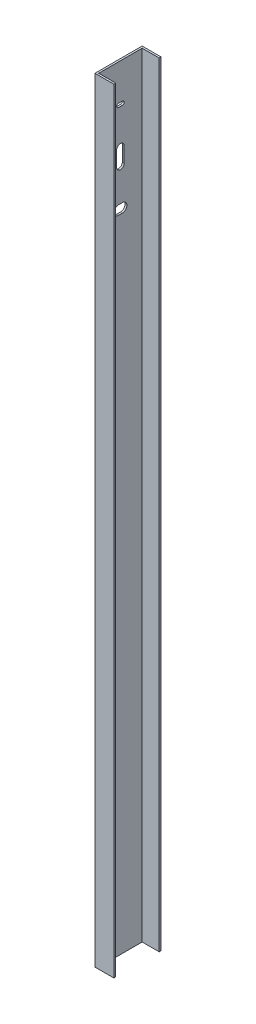
from build123d import *

# Parameters (mm, degrees)
SKETCH1_W           = 10
SKETCH1_H           = 25
BOSS_EXTRUDE1_DEPTH = 410
SKETCH2_W           = 9
SKETCH2_H           = 23
CUT_EXTRUDE1_DEPTH  = 410
CUT_EXTRUDE2_DEPTH  = 410
CUT_EXTRUDE3_DEPTH  = 410
CUT_EXTRUDE4_DEPTH  = 410


with BuildPart() as part:
    # Sketch1 → Boss-Extrude1 (new body)
    with BuildSketch(Plane(origin=(0, 0, 0), x_dir=(1, 0, 0), z_dir=(0, 1, 0))):
        with Locations((5, -12.5)):
            Rectangle(SKETCH1_W, SKETCH1_H)
    extrude(amount=BOSS_EXTRUDE1_DEPTH)

    # Sketch2 → Cut-Extrude1 (cut)
    with BuildSketch(Plane(origin=(0, 410, 0), x_dir=(1, 0, 0), z_dir=(0, 1, 0))):
        with Locations((5.5, -12.5)):
            Rectangle(SKETCH2_W, SKETCH2_H)
    extrude(amount=-CUT_EXTRUDE1_DEPTH, mode=Mode.SUBTRACT)

    # Sketch3 → Cut-Extrude2 (cut)
    with BuildSketch(Plane.ZY):
        with BuildLine():
            Line((11.5, 391), (13.5, 391))
            ThreePointArc((13.5, 391), (14.5, 390), (13.5, 389))
            Line((13.5, 389), (11.5, 389))
            ThreePointArc((11.5, 389), (10.5, 390), (11.5, 391))
        make_face()
    extrude(amount=-CUT_EXTRUDE2_DEPTH, mode=Mode.SUBTRACT)

    # Sketch3<3> → Cut-Extrude3 (cut)
    with BuildSketch(Plane.ZY):
        with BuildLine():
            Line((14.5, 370), (14.5, 362))
            ThreePointArc((14.5, 362), (12.5, 360), (10.5, 362))
            Line((10.5, 362), (10.5, 370))
            ThreePointArc((10.5, 370), (12.5, 372), (14.5, 370))
        make_face()
    extrude(amount=-CUT_EXTRUDE3_DEPTH, mode=Mode.SUBTRACT)

    # Sketch3<4> → Cut-Extrude4 (cut)
    with BuildSketch(Plane.ZY):
        with BuildLine():
            Line((11.5, 344.4), (13.5, 344.4))
            ThreePointArc((13.5, 344.4), (15.9, 342), (13.5, 339.6))
            Line((13.5, 339.6), (11.5, 339.6))
            ThreePointArc((11.5, 339.6), (9.1, 342), (11.5, 344.4))
        make_face()
    extrude(amount=-CUT_EXTRUDE4_DEPTH, mode=Mode.SUBTRACT)


solid = part.part
